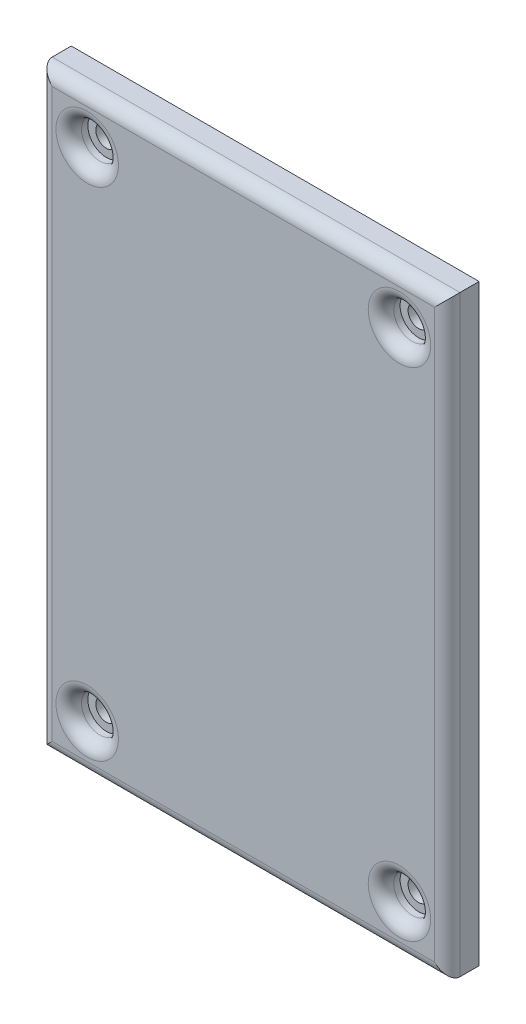
from build123d import *

# Parameters (mm, degrees)
SKIZZE1_W                       = 64
SKIZZE1_H                       = 93
SKIZZE1_R                       = 1.65
AUFSATZ_LINEAR_AUSTRAGEN2_DEPTH = 5
SKIZZE2_R                       = 2.9
SCHNITT_LINEAR_AUSTRAGEN1_DEPTH = 3
VERRUNDUNG1_R                   = 2


with BuildPart() as part:
    # Skizze1 → Aufsatz-Linear austragen2 (new body)
    with BuildSketch(Plane.XY):
        Rectangle(SKIZZE1_W, SKIZZE1_H)
        with Locations((-24.5, 39)):
            Circle(SKIZZE1_R, mode=Mode.SUBTRACT)
        with Locations(Location((24.5, 39, 0), (0, 0, 180))):
            Circle(SKIZZE1_R, mode=Mode.SUBTRACT)
        with Locations((24.5, -39)):
            Circle(SKIZZE1_R, mode=Mode.SUBTRACT)
        with Locations(Location((-24.5, -39, 0), (0, 0, 180))):
            Circle(SKIZZE1_R, mode=Mode.SUBTRACT)
    extrude(amount=AUFSATZ_LINEAR_AUSTRAGEN2_DEPTH)

    # Skizze2 → Schnitt-Linear austragen1 (cut)
    with BuildSketch(Plane.XY.offset(5)):
        with Locations((-24.5, 39)):
            Circle(SKIZZE2_R)
        with Locations(Location((24.5, 39, 0), (0, 0, 180))):
            Circle(SKIZZE2_R)
        with Locations((24.5, -39)):
            Circle(SKIZZE2_R)
        with Locations(Location((-24.5, -39, 0), (0, 0, 180))):
            Circle(SKIZZE2_R)
    extrude(amount=-SCHNITT_LINEAR_AUSTRAGEN1_DEPTH, mode=Mode.SUBTRACT)

    # Verrundung1
    verrundung1_edges = [part.edges().sort_by_distance(p)[0] for p in [
        (-32, 0, 5),
        (0, -46.5, 5),
        (-21.6, -39, 5),
        (21.6, -39, 5),
        (27.4, 39, 5),
        (-27.4, 39, 5),
        (32, 0, 5),
        (0, 46.5, 5),
    ]]
    fillet(verrundung1_edges, radius=VERRUNDUNG1_R)


solid = part.part
